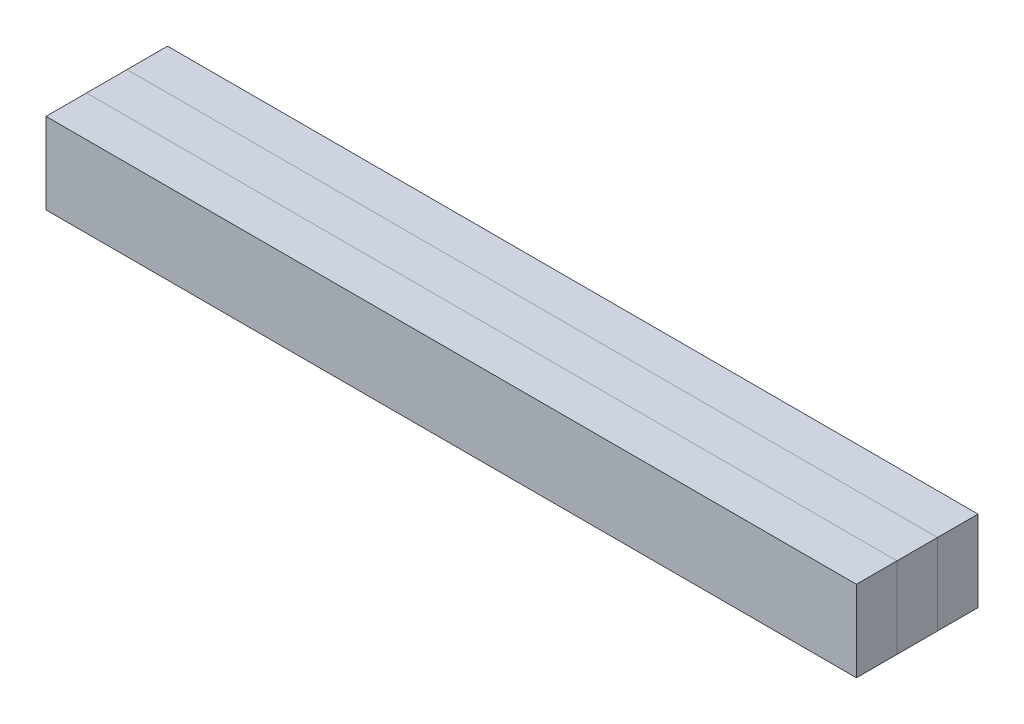
from build123d import *

# Parameters (mm, degrees)
SKETCH_1_W      = 100
SKETCH_1_H      = 10
EXTRUDE_1_DEPTH = 5
SKETCH_4_W      = 100
SKETCH_4_H      = 10
EXTRUDE_3_DEPTH = 5
SKETCH_5_W      = 100
SKETCH_5_H      = 10
EXTRUDE_4_DEPTH = 5


with BuildPart() as part:
    # ｽｹｯﾁ1 → ﾎﾞｽ - 押し出し1 (new body)
    with BuildSketch(Plane.XY):
        with Locations((50, 5)):
            Rectangle(SKETCH_1_W, SKETCH_1_H)
    extrude(amount=EXTRUDE_1_DEPTH)


with BuildPart() as body_2:
    # ｽｹｯﾁ4 → ﾎﾞｽ - 押し出し3 (new body)
    with BuildSketch(Plane(origin=(0, 0, 0), x_dir=(-1, 0, 0), z_dir=(0, 0, -1))):
        with Locations((-50, 5)):
            Rectangle(SKETCH_4_W, SKETCH_4_H)
    extrude(amount=EXTRUDE_3_DEPTH)


with BuildPart() as body_3:
    # ｽｹｯﾁ5 → ﾎﾞｽ - 押し出し4 (new body)
    with BuildSketch(Plane(origin=(0, 0, -5), x_dir=(-1, 0, 0), z_dir=(0, 0, -1))):
        with Locations((-50, 5)):
            Rectangle(SKETCH_5_W, SKETCH_5_H)
    extrude(amount=EXTRUDE_4_DEPTH)


solid = Compound([part.part, body_2.part, body_3.part])
